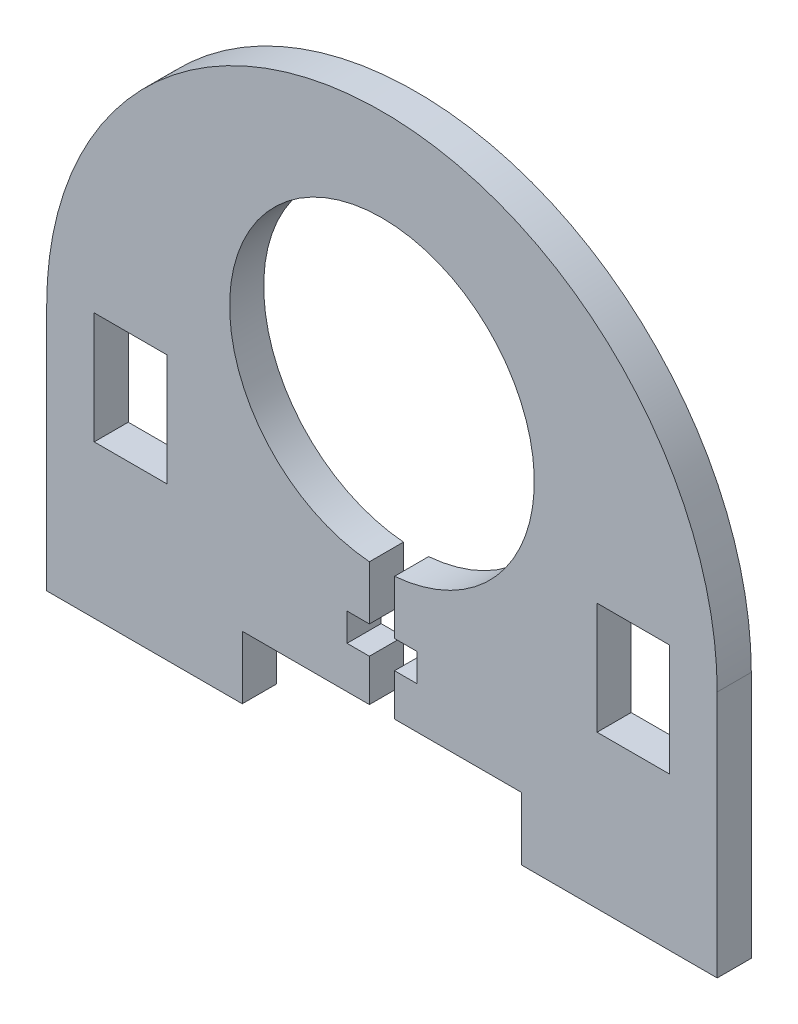
from build123d import *

# Parameters (mm, degrees)
BOSS_EXTRUDE1_DEPTH = 3.0988
CUT_EXTRUDE1_REACH  = 53.777
SKETCH2_R           = 13.85
CUT_EXTRUDE2_REACH  = 53.777
SKETCH3_W           = 25.4
SKETCH3_H           = 5.715
CUT_EXTRUDE4_REACH  = 53.777
CUT_EXTRUDE5_REACH  = 53.777
SKETCH6_W           = 6.604
SKETCH6_H           = 10.16


with BuildPart() as part:
    # Sketch1 → Boss-Extrude1 (new body)
    with BuildSketch(Plane.XY):
        with BuildLine():
            Line((30.48, -11.260079969), (-30.48, -11.260079969))
            Line((-30.48, -11.260079969), (-30.48, 11.260079969))
            ThreePointArc((-30.48, 11.260079969), (0, 41.740079969), (30.48, 11.260079969))
            Line((30.48, 11.260079969), (30.48, -11.260079969))
        make_face()
    extrude(amount=BOSS_EXTRUDE1_DEPTH)

    # Sketch2 → Cut-Extrude1 (cut, up to next)
    with BuildSketch(Plane.XY.offset(3.0988), mode=Mode.PRIVATE) as cut_extrude1_sk1:
        with Locations((0, 19.504919969)):
            Circle(SKETCH2_R)
    cut_extrude1_tool1 = extrude(cut_extrude1_sk1.sketch, amount=-CUT_EXTRUDE1_REACH, mode=Mode.PRIVATE) & part.part
    add(cut_extrude1_tool1.solids().sort_by_distance((0, 19.50492, 3.0988))[0], mode=Mode.SUBTRACT)

    # Sketch3 → Cut-Extrude2 (cut, up to next)
    with BuildSketch(Plane.XY.offset(3.0988), mode=Mode.PRIVATE) as cut_extrude2_sk1:
        with Locations((0, -8.402579969)):
            Rectangle(SKETCH3_W, SKETCH3_H)
    cut_extrude2_tool1 = extrude(cut_extrude2_sk1.sketch, amount=-CUT_EXTRUDE2_REACH, mode=Mode.PRIVATE) & part.part
    add(cut_extrude2_tool1.solids().sort_by_distance((0, -8.40258, 3.0988))[0], mode=Mode.SUBTRACT)

    # Sketch5 → Cut-Extrude4 (cut, up to next)
    with BuildSketch(Plane.XY.offset(3.0988), mode=Mode.PRIVATE) as cut_extrude4_sk1:
        Polygon((3.175, -1.735079969), (1.143, -1.735079969), (1.143, -5.545079969), (-1.143, -5.545079969), (-1.143, -1.735079969), (-3.175, -1.735079969), (-3.175, 0.804920031), (-1.143, 0.804920031), (-1.143, 8.424920031), (1.143, 8.424920031), (1.143, 0.804920031), (3.175, 0.804920031), align=None)
    cut_extrude4_tool1 = extrude(cut_extrude4_sk1.sketch, amount=-CUT_EXTRUDE4_REACH, mode=Mode.PRIVATE) & part.part
    add(cut_extrude4_tool1.solids().sort_by_distance((0, 0.974577, 3.0988))[0], mode=Mode.SUBTRACT)

    # Sketch6 → Cut-Extrude5 (cut, up to next)
    with BuildSketch(Plane.XY.offset(3.0988), mode=Mode.PRIVATE) as cut_extrude5_sk1:
        with Locations((22.86, 7.710464847)):
            Rectangle(SKETCH6_W, SKETCH6_H)
    cut_extrude5_tool1 = extrude(cut_extrude5_sk1.sketch, amount=-CUT_EXTRUDE5_REACH, mode=Mode.PRIVATE) & part.part
    # Sketch6 → Cut-Extrude5 (cut, up to next)
    with BuildSketch(Plane.XY.offset(3.0988), mode=Mode.PRIVATE) as cut_extrude5_sk2:
        with Locations((-22.86, 7.710464847)):
            Rectangle(SKETCH6_W, SKETCH6_H)
    cut_extrude5_tool2 = extrude(cut_extrude5_sk2.sketch, amount=-CUT_EXTRUDE5_REACH, mode=Mode.PRIVATE) & part.part
    add(cut_extrude5_tool1.solids().sort_by_distance((22.86, 7.710465, 3.0988))[0], mode=Mode.SUBTRACT)
    add(cut_extrude5_tool2.solids().sort_by_distance((-22.86, 7.710465, 3.0988))[0], mode=Mode.SUBTRACT)


solid = part.part
